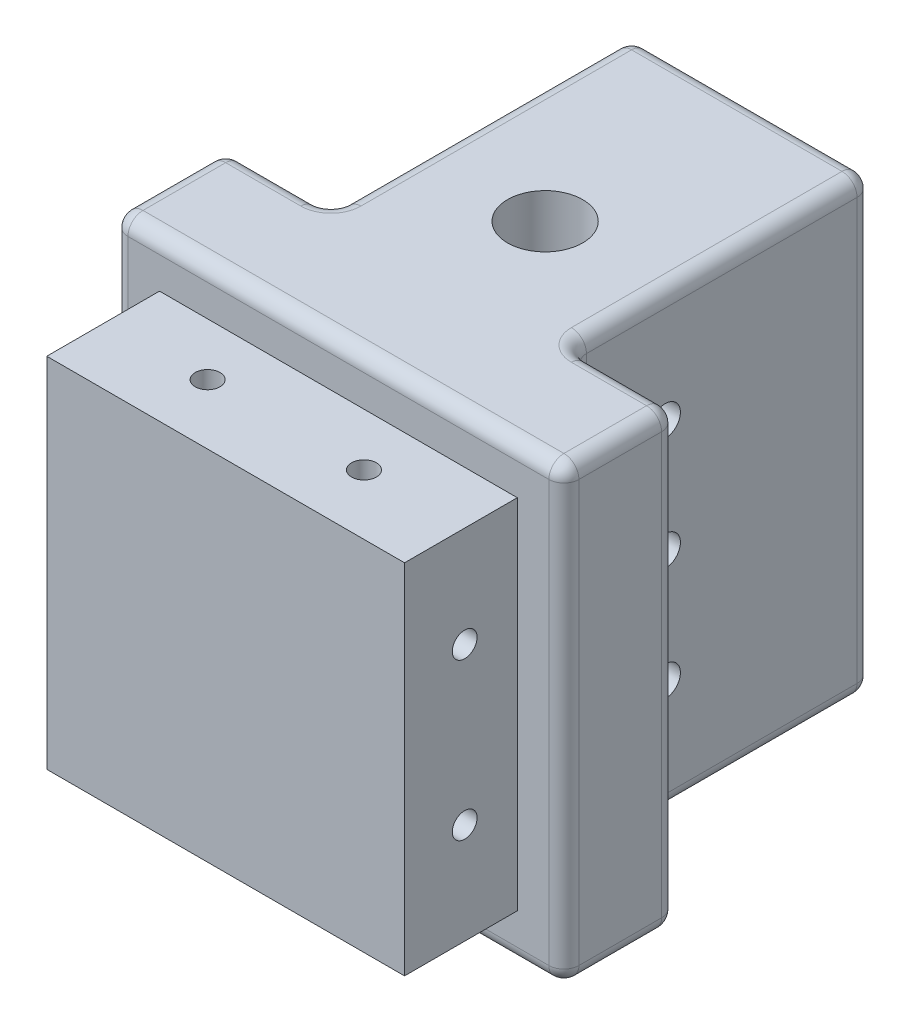
from build123d import *

# Parameters (mm, degrees)
SKETCH2_W                  = 60
SKETCH2_H                  = 60
BOSS_EXTRUDE1_DEPTH        = 70
SKETCH3_OUTSIDE_W          = 84
SKETCH3_OUTSIDE_H          = 84
SKETCH3_OUTSIDE_W_2        = 47.6
SKETCH3_OUTSIDE_H_2        = 47.6
CUT_EXTRUDE1_DEPTH         = 15
M4_TAPPED_HOLE1_AT_2_COUNT = 2
M4_TAPPED_HOLE1_AT_2_PITCH = 20.8
CIRPATTERN1_COUNT          = 4
SKETCH19_R                 = 5
CUT_EXTRUDE2_DEPTH         = 97.953597148
SKETCH21_W                 = 14
SKETCH21_H                 = 60
CUT_EXTRUDE3_DEPTH         = 40
F_4_0MM_DOWEL_HOLE1_D      = 4
FILLET1_R                  = 2


with BuildPart() as part:
    # Sketch2 → Boss-Extrude1 (new body)
    with BuildSketch(Plane.XY):
        Rectangle(SKETCH2_W, SKETCH2_H)
    extrude(amount=BOSS_EXTRUDE1_DEPTH)

    # Sketch3 outside → Cut-Extrude1 (cut)
    with BuildSketch(Plane.XY.offset(70)):
        Rectangle(SKETCH3_OUTSIDE_W, SKETCH3_OUTSIDE_H)
        Rectangle(SKETCH3_OUTSIDE_W_2, SKETCH3_OUTSIDE_H_2, mode=Mode.SUBTRACT)
    extrude(amount=-CUT_EXTRUDE1_DEPTH, mode=Mode.SUBTRACT)

    # Sketch16 → M4 Tapped Hole1 (revolve, cut)
    with BuildSketch(Plane(origin=(23.8, -10.4, 62), x_dir=(0, 0, -1), z_dir=(0, 1, 0))):
        Polygon((0, 0), (0, 12.491420021), (1.65, 11.5), (1.65, 0), align=None)
    m4_tapped_hole1 = revolve(axis=Axis((30.15, -10.4, 62), (-1, 0, 0)), mode=Mode.SUBTRACT)

    # M4 Tapped Hole1 at 2: M4 Tapped Hole1 ×2
    with Locations(*[(0, i * M4_TAPPED_HOLE1_AT_2_PITCH, 0) for i in range(1, M4_TAPPED_HOLE1_AT_2_COUNT)]):
        add(m4_tapped_hole1, mode=Mode.SUBTRACT)

    # CirPattern1: M4 Tapped Hole1 ×4 about axis
    cirpattern1_axis = Axis((0, 0, 70), (0, 0, -1))
    for i in range(1, CIRPATTERN1_COUNT):
        add(m4_tapped_hole1.rotate(cirpattern1_axis, i * 360 / CIRPATTERN1_COUNT), mode=Mode.SUBTRACT)

    # CirPattern1 copy 1 sketch → CirPattern1 copy 1 (revolve, cut)
    with BuildSketch(Plane(origin=(10.4, -23.8, 62), x_dir=(0, 0, -1), z_dir=(1, 0, 0))):
        Polygon((0, 0), (0, 12.491420021), (1.65, 11.5), (1.65, 0), align=None)
    revolve(axis=Axis((10.4, -30.15, 62), (0, 1, 0)), mode=Mode.SUBTRACT)

    # CirPattern1 copy 2 sketch → CirPattern1 copy 2 (revolve, cut)
    with BuildSketch(Plane(origin=(-23.8, -10.4, 62), x_dir=(0, 0, -1), z_dir=(0, -1, 0))):
        Polygon((0, 0), (0, 12.491420021), (1.65, 11.5), (1.65, 0), align=None)
    revolve(axis=Axis((-30.15, -10.4, 62), (1, 0, 0)), mode=Mode.SUBTRACT)

    # CirPattern1 copy 3 sketch → CirPattern1 copy 3 (revolve, cut)
    with BuildSketch(Plane(origin=(-10.4, 23.8, 62), x_dir=(0, 0, -1), z_dir=(-1, 0, 0))):
        Polygon((0, 0), (0, 12.491420021), (1.65, 11.5), (1.65, 0), align=None)
    revolve(axis=Axis((-10.4, 30.15, 62), (0, -1, 0)), mode=Mode.SUBTRACT)

    # Sketch19 → Cut-Extrude2 (cut, through all)
    with BuildSketch(Plane(origin=(0, 30, 0), x_dir=(1, 0, 0), z_dir=(0, 1, 0))):
        with Locations(Location((0, -27.5, 0), (0, 0, 270))):
            Circle(SKETCH19_R)
    extrude(amount=-CUT_EXTRUDE2_DEPTH, mode=Mode.SUBTRACT)

    # Sketch21 → Cut-Extrude3 (cut)
    with BuildSketch(Plane(origin=(0, 0, 0), x_dir=(-1, 0, 0), z_dir=(0, 0, -1))):
        with Locations((-23, 0)):
            Rectangle(SKETCH21_W, SKETCH21_H)
    cut_extrude3 = extrude(amount=-CUT_EXTRUDE3_DEPTH, mode=Mode.SUBTRACT)

    # Mirror1: Cut-Extrude3 across plane
    add(cut_extrude3.mirror(Plane(origin=(0, 0, 0), x_dir=(0, 0, 1), z_dir=(1, 0, 0))), mode=Mode.SUBTRACT)

    # Ø4.0mm Dowel Hole1 (through all)
    with Locations(Plane.ZY.offset(16)):
        with Locations((27.5, 15), (27.5, 0), (27.5, -15)):
            Hole(F_4_0MM_DOWEL_HOLE1_D / 2)

    # Fillet1
    fillet1_edges = [part.edges().sort_by_distance(p)[0] for p in [
        (0, -30, 0),
        (-16, 0, 0),
        (-16, -30, 20),
        (-16, 30, 20),
        (-30, 0, 40),
        (-23, -30, 40),
        (-16, 0, 40),
        (-23, 30, 40),
        (30, -30, 47.5),
        (-30, -30, 47.5),
        (0, -30, 55),
        (-30, 30, 47.5),
        (30, 30, 47.5),
        (30, 0, 55),
        (0, 30, 55),
        (-30, 0, 55),
        (0, 30, 0),
        (30, 0, 40),
        (23, 30, 40),
        (16, 0, 40),
        (16, 30, 20),
        (23, -30, 40),
        (16, -30, 20),
        (16, 0, 0),
    ]]
    fillet(fillet1_edges, radius=FILLET1_R)


solid = part.part
